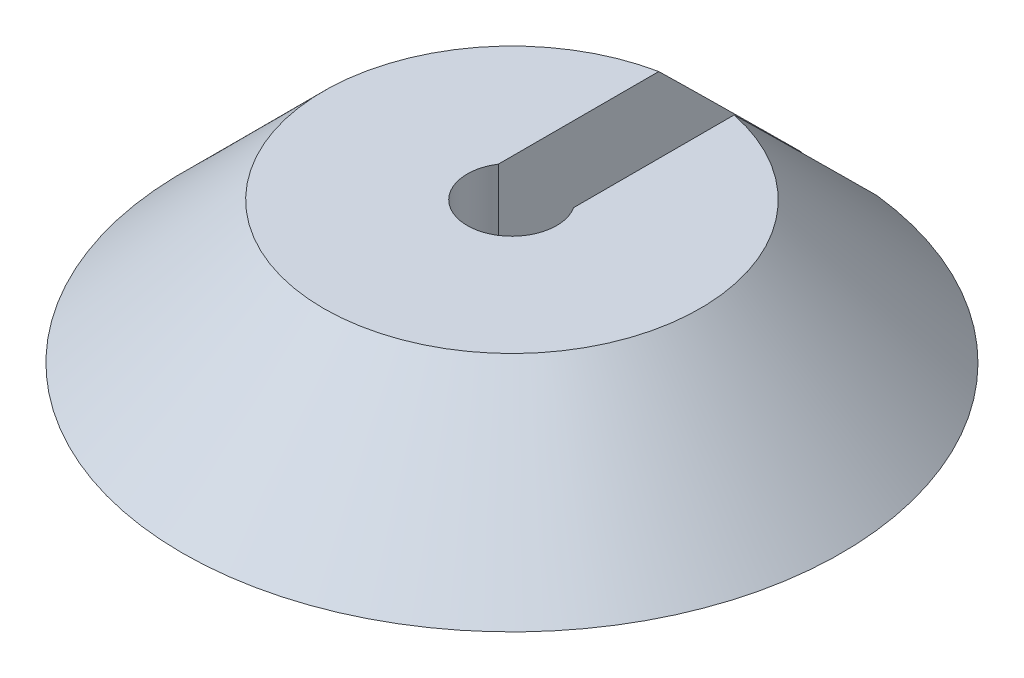
from build123d import *

# Parameters (mm, degrees)
CUT_EXTRUDE1_DEPTH      = 11.344080433
CUT_EXTRUDE1_DEPTH_BACK = 11.344080433
SKETCH2_R               = 0.95
CUT_EXTRUDE2_DEPTH      = 11.344080433
CUT_EXTRUDE2_DEPTH_BACK = 11.344080433


with BuildPart() as part:
    # Sketch1 → Revolve1 (revolve)
    with BuildSketch(Plane.XY):
        Polygon((0, 0), (7, 0), (4, 3), (0, 3), align=None)
    revolve(axis=Axis((0, -1026.355569878, 0), (0, 1, 0)))

    # Sketch2 → Cut-Extrude1 (cut, two sides: drawn at the far end of the back side and taken through both)
    with BuildSketch(Plane(origin=(0, 3, 0), x_dir=(1, 0, 0), z_dir=(0, 1, 0)).offset(-CUT_EXTRUDE1_DEPTH_BACK)):
        with Locations(Location((0, 0, 0), (0, 0, 180))):
            Circle(SKETCH2_R)
    extrude(amount=CUT_EXTRUDE1_DEPTH + CUT_EXTRUDE1_DEPTH_BACK, mode=Mode.SUBTRACT)

    # Sketch3 → Cut-Extrude2 (cut, two sides: drawn at the far end of the back side and taken through both)
    with BuildSketch(Plane(origin=(0, 3, 0), x_dir=(1, 0, 0), z_dir=(0, 1, 0)).offset(-CUT_EXTRUDE2_DEPTH_BACK)):
        with BuildLine():
            Line((-0.8, 0.512347538), (-0.8, 6.95413546))
            ThreePointArc((-0.8, 6.95413546), (0, 7), (0.8, 6.95413546))
            Line((0.8, 6.95413546), (0.8, 0.512347538))
            ThreePointArc((0.8, 0.512347538), (0, 0.95), (-0.8, 0.512347538))
        make_face()
    extrude(amount=CUT_EXTRUDE2_DEPTH + CUT_EXTRUDE2_DEPTH_BACK, mode=Mode.SUBTRACT)


solid = part.part
